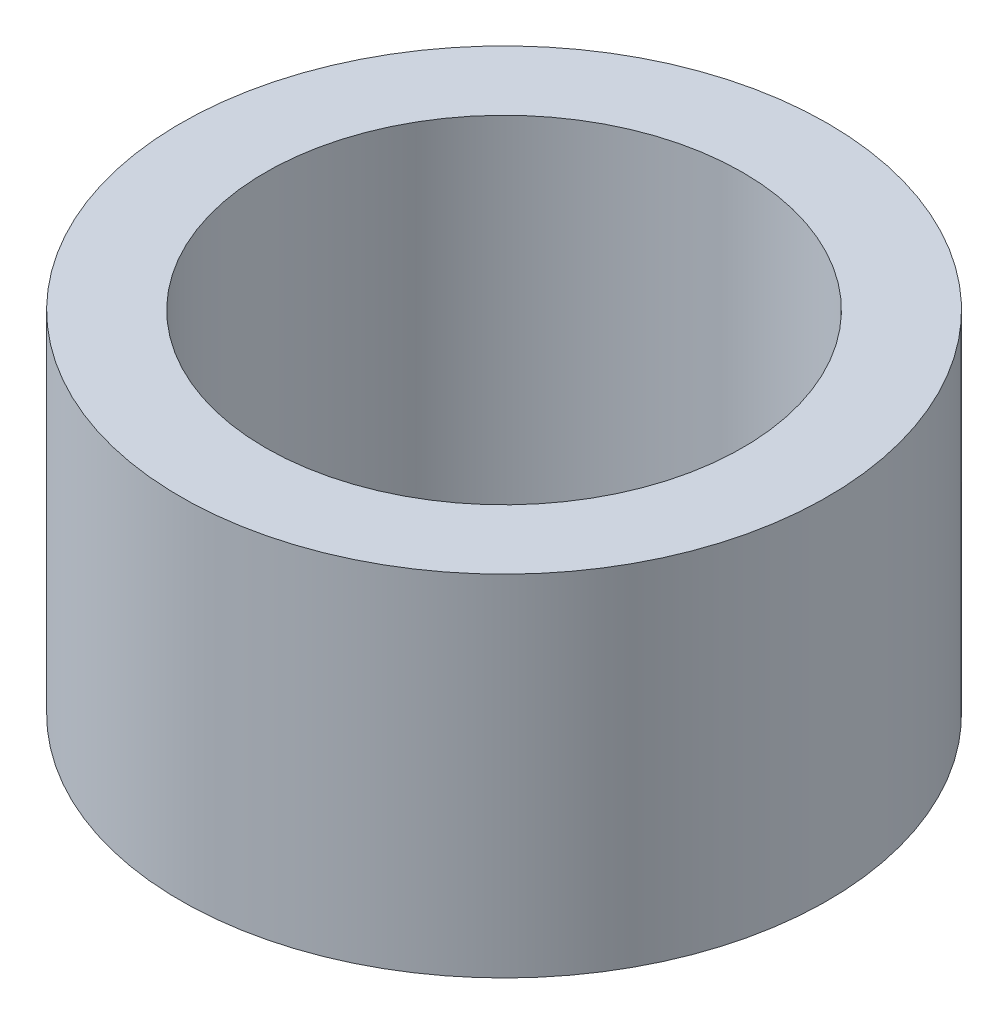
from build123d import *

# Parameters (mm, degrees)
SKETCH1_R           = 6.5786
SKETCH1_R_2         = 4.8514
BOSS_EXTRUDE1_DEPTH = 7.112


with BuildPart() as part:
    # Sketch1 → Boss-Extrude1 (new body)
    with BuildSketch(Plane(origin=(0, 7.112, 0), x_dir=(1, 0, 0), z_dir=(0, 1, 0))):
        with Locations(Location((0, 0, 0), (0, 0, 90))):
            Circle(SKETCH1_R)
        with Locations(Location((0, 0, 0), (0, 0, 90))):
            Circle(SKETCH1_R_2, mode=Mode.SUBTRACT)
    extrude(amount=-BOSS_EXTRUDE1_DEPTH)


solid = part.part
